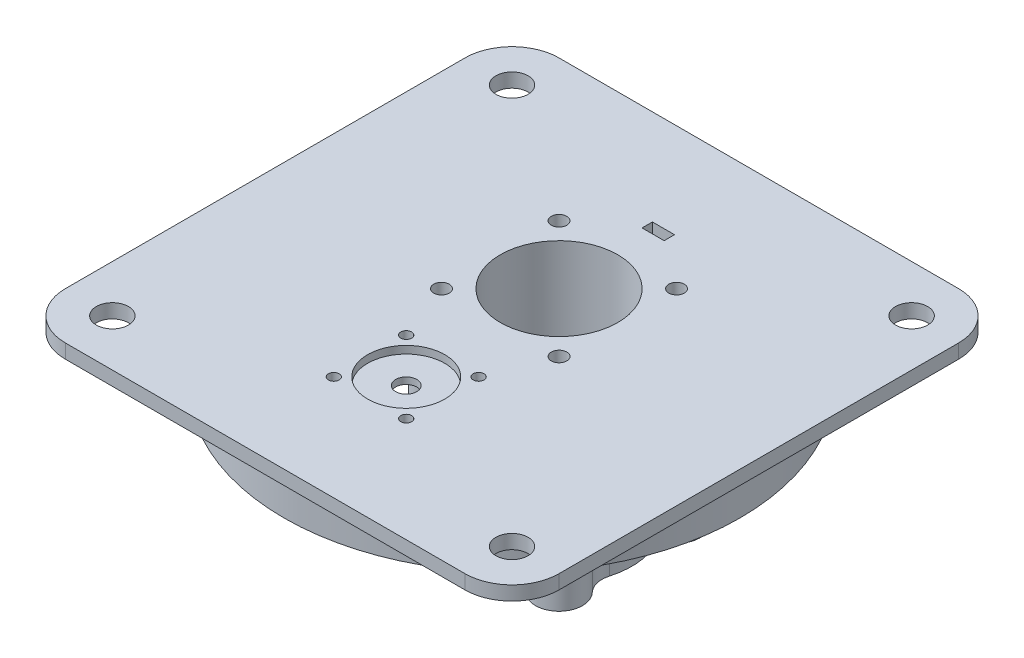
from build123d import *

# Parameters (mm, degrees)
SKETCH1_W           = 105
SKETCH1_H           = 105
BOSS_EXTRUDE1_DEPTH = 3
SKETCH3_R           = 1.15
SKETCH3_R_2         = 2.25
CUT_EXTRUDE1_DEPTH  = 75.306796459
SKETCH4_R           = 8.2
CUT_EXTRUDE2_DEPTH  = 1.6
SKETCH5_R           = 48.5
SKETCH5_R_2         = 45.5
BOSS_EXTRUDE3_DEPTH = 10
SKETCH6_R           = 12.5
CUT_EXTRUDE3_DEPTH  = 75.916620319
BOSS_EXTRUDE4_START = 40.4
SKETCH7_R           = 12.5
BOSS_EXTRUDE4_DEPTH = 40.4
FILLET1_R           = 5
SKETCH8_R           = 2.15
CUT_EXTRUDE4_DEPTH  = 10
SKETCH9_R           = 1.65
CUT_EXTRUDE5_DEPTH  = 82.412898241
FILLET2_R           = 10
SKETCH10_R          = 3.419507724
CUT_EXTRUDE6_DEPTH  = 85.526090694
SKETCH11_W          = 7.1
SKETCH11_H          = 4.6
SKETCH11_W_2        = 4.7
SKETCH11_H_2        = 2.2
BOSS_EXTRUDE5_DEPTH = 5.7
SKETCH12_W          = 7.1
SKETCH12_H          = 4.6
BOSS_EXTRUDE6_DEPTH = 1
SKETCH13_W          = 4.7
SKETCH13_H          = 2.2
CUT_EXTRUDE7_DEPTH  = 3


with BuildPart() as part:
    # Sketch1 → Boss-Extrude1 (new body)
    with BuildSketch(Plane(origin=(0, 0, 0), x_dir=(1, 0, 0), z_dir=(0, 1, 0))):
        Rectangle(SKETCH1_W, SKETCH1_H)
    extrude(amount=BOSS_EXTRUDE1_DEPTH)

    # Sketch3 → Cut-Extrude1 (cut, through all)
    with BuildSketch(Plane(origin=(0, 3, 0), x_dir=(1, 0, 0), z_dir=(0, 1, 0))):
        with Locations(Location((-7.7, -30.2, 0), (0, 0, 270))):
            Circle(SKETCH3_R)
        with Locations(Location((7.7, -30.2, 0), (0, 0, 270))):
            Circle(SKETCH3_R)
        with Locations(Location((7.7, -14.8, 0), (0, 0, 270))):
            Circle(SKETCH3_R)
        with Locations(Location((-7.7, -14.8, 0), (0, 0, 270))):
            Circle(SKETCH3_R)
        with Locations(Location((0, -22.5, 0), (0, 0, 270))):
            Circle(SKETCH3_R_2)
    extrude(amount=-CUT_EXTRUDE1_DEPTH, mode=Mode.SUBTRACT)

    # Sketch4 → Cut-Extrude2 (cut)
    with BuildSketch(Plane(origin=(0, 3, 0), x_dir=(1, 0, 0), z_dir=(0, 1, 0))):
        with Locations(Location((0, -22.5, 0), (0, 0, 270))):
            Circle(SKETCH4_R)
    extrude(amount=-CUT_EXTRUDE2_DEPTH, mode=Mode.SUBTRACT)

    # Sketch5 → Boss-Extrude3 (add)
    with BuildSketch(Plane.XZ):
        with Locations(Location((0, 0, 0), (0, 0, 270))):
            Circle(SKETCH5_R)
        with Locations(Location((0, 0, 0), (0, 0, 270))):
            Circle(SKETCH5_R_2, mode=Mode.SUBTRACT)
    extrude(amount=BOSS_EXTRUDE3_DEPTH)

    # Sketch6 → Cut-Extrude3 (cut, through all)
    with BuildSketch(Plane.XZ):
        with Locations(Location((0, -10, 0), (0, 0, 270))):
            Circle(SKETCH6_R)
    extrude(amount=-CUT_EXTRUDE3_DEPTH, mode=Mode.SUBTRACT)

    # Sketch7 → Boss-Extrude4 (add)
    with BuildSketch(Plane.XZ.offset(BOSS_EXTRUDE4_START)):
        with BuildLine():
            ThreePointArc((-7.60254763, 3.50745237), (-16.035533906, 6.035533906), (-13.50745237, -2.39745237))
            ThreePointArc((-13.50745237, -2.39745237), (-15.5, -10), (-13.50745237, -17.60254763))
            ThreePointArc((-13.50745237, -17.60254763), (-16.035533906, -26.035533906), (-7.60254763, -23.50745237))
            ThreePointArc((-7.60254763, -23.50745237), (0, -25.5), (7.60254763, -23.50745237))
            ThreePointArc((7.60254763, -23.50745237), (16.035533906, -26.035533906), (13.50745237, -17.60254763))
            ThreePointArc((13.50745237, -17.60254763), (15.5, -10), (13.50745237, -2.39745237))
            ThreePointArc((13.50745237, -2.39745237), (16.035533906, 6.035533906), (7.60254763, 3.50745237))
            ThreePointArc((7.60254763, 3.50745237), (0, 5.5), (-7.60254763, 3.50745237))
        make_face()
        with Locations(Location((0, -10, 0), (0, 0, 270))):
            Circle(SKETCH7_R, mode=Mode.SUBTRACT)
    extrude(amount=-BOSS_EXTRUDE4_DEPTH)

    # Fillet1
    fillet1_edges = [part.edges().sort_by_distance(p)[0] for p in [
        (7.60254763, -20.2, 3.50745237),
        (-7.60254763, -20.2, 3.50745237),
        (-13.50745237, -20.2, -2.39745237),
        (-13.50745237, -20.2, -17.60254763),
        (-7.60254763, -20.2, -23.50745237),
        (7.60254763, -20.2, -23.50745237),
        (13.50745237, -20.2, -17.60254763),
        (13.50745237, -20.2, -2.39745237),
    ]]
    fillet(fillet1_edges, radius=FILLET1_R)

    # Sketch8 → Cut-Extrude4 (cut)
    with BuildSketch(Plane.XZ.offset(40.4)):
        with Locations(Location((-12.5, -22.5, 0), (0, 0, 270))):
            Circle(SKETCH8_R)
        with Locations(Location((12.5, -22.5, 0), (0, 0, 270))):
            Circle(SKETCH8_R)
        with Locations(Location((-12.5, 2.5, 0), (0, 0, 270))):
            Circle(SKETCH8_R)
        with Locations(Location((12.5, 2.5, 0), (0, 0, 270))):
            Circle(SKETCH8_R)
    extrude(amount=-CUT_EXTRUDE4_DEPTH, mode=Mode.SUBTRACT)

    # Sketch9 → Cut-Extrude5 (cut, through all)
    with BuildSketch(Plane.XZ.offset(30.4)):
        with Locations(Location((12.5, -22.5, 0), (0, 0, 270))):
            Circle(SKETCH9_R)
        with Locations(Location((-12.5, -22.5, 0), (0, 0, 270))):
            Circle(SKETCH9_R)
        with Locations(Location((-12.5, 2.5, 0), (0, 0, 270))):
            Circle(SKETCH9_R)
        with Locations(Location((12.5, 2.5, 0), (0, 0, 270))):
            Circle(SKETCH9_R)
    extrude(amount=-CUT_EXTRUDE5_DEPTH, mode=Mode.SUBTRACT)

    # Fillet2
    fillet2_edges = [part.edges().sort_by_distance(p)[0] for p in [
        (-52.5, 1.5, -52.5),
        (52.5, 1.5, -52.5),
        (52.5, 1.5, 52.5),
        (-52.5, 1.5, 52.5),
    ]]
    fillet(fillet2_edges, radius=FILLET2_R)

    # Sketch10 → Cut-Extrude6 (cut, through all)
    with BuildSketch(Plane.XZ):
        with Locations(Location((-42.5, -42.5, 0), (0, 0, 270))):
            Circle(SKETCH10_R)
        with Locations(Location((42.5, -42.5, 0), (0, 0, 270))):
            Circle(SKETCH10_R)
        with Locations(Location((42.5, 42.5, 0), (0, 0, 270))):
            Circle(SKETCH10_R)
        with Locations(Location((-42.5, 42.5, 0), (0, 0, 270))):
            Circle(SKETCH10_R)
    extrude(amount=-CUT_EXTRUDE6_DEPTH, mode=Mode.SUBTRACT)

    # Sketch11 → Boss-Extrude5 (add)
    with BuildSketch(Plane.XZ):
        with Locations((0, -31.116528476)):
            Rectangle(SKETCH11_W, SKETCH11_H)
        with Locations((0, -31.116528476)):
            Rectangle(SKETCH11_W_2, SKETCH11_H_2, mode=Mode.SUBTRACT)
    extrude(amount=BOSS_EXTRUDE5_DEPTH)

    # Sketch12 → Boss-Extrude6 (add)
    with BuildSketch(Plane.XZ.offset(5.7)):
        with Locations((0, -31.116528476)):
            Rectangle(SKETCH12_W, SKETCH12_H)
    extrude(amount=BOSS_EXTRUDE6_DEPTH)

    # Sketch13 → Cut-Extrude7 (cut)
    with BuildSketch(Plane.XZ):
        with Locations((0, -31.116528476)):
            Rectangle(SKETCH13_W, SKETCH13_H)
    extrude(amount=-CUT_EXTRUDE7_DEPTH, mode=Mode.SUBTRACT)


solid = part.part
